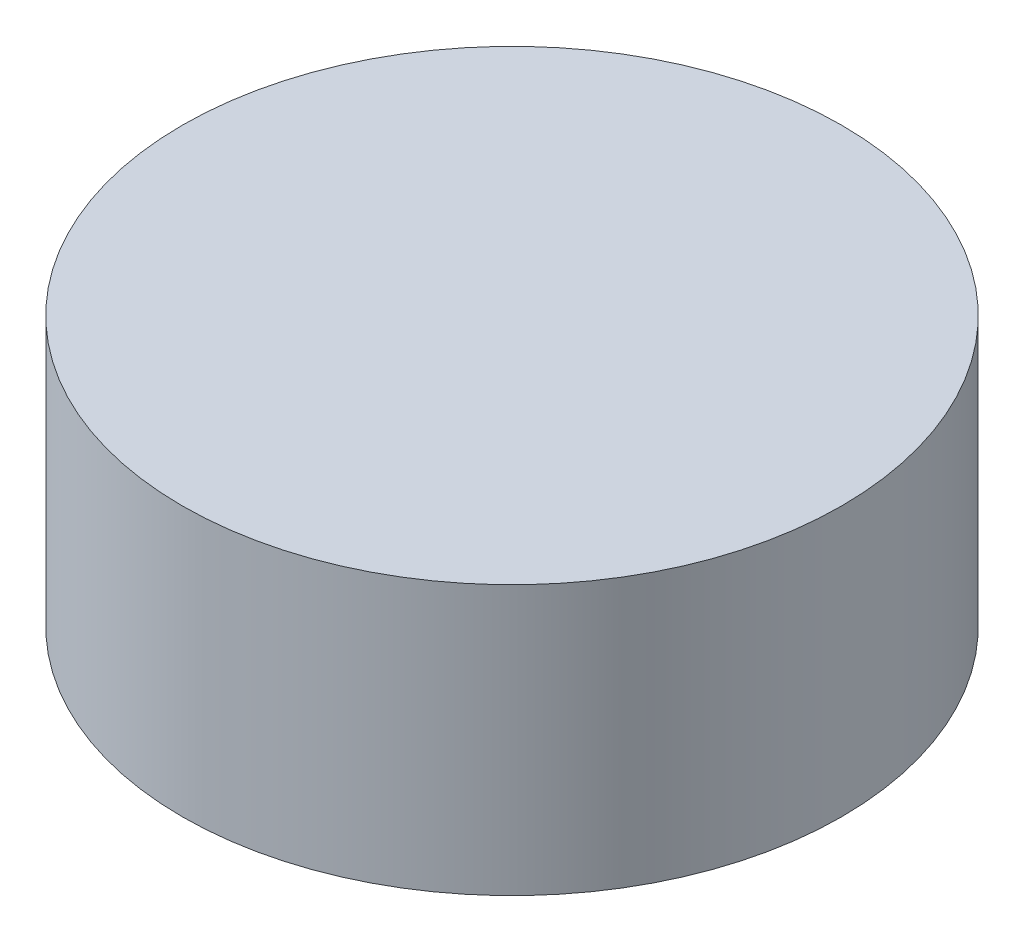
from build123d import *

# Parameters (mm, degrees)
CROQUIS1_R              = 3
SALIENTE_EXTRUIR1_DEPTH = 2.45


with BuildPart() as part:
    # Croquis1 → Saliente-Extruir1 (new body)
    with BuildSketch(Plane(origin=(0, 0, 0), x_dir=(1, 0, 0), z_dir=(0, 1, 0))):
        with Locations(Location((0, 0, 0), (0, 0, 270))):
            Circle(CROQUIS1_R)
    extrude(amount=SALIENTE_EXTRUIR1_DEPTH)


solid = part.part
